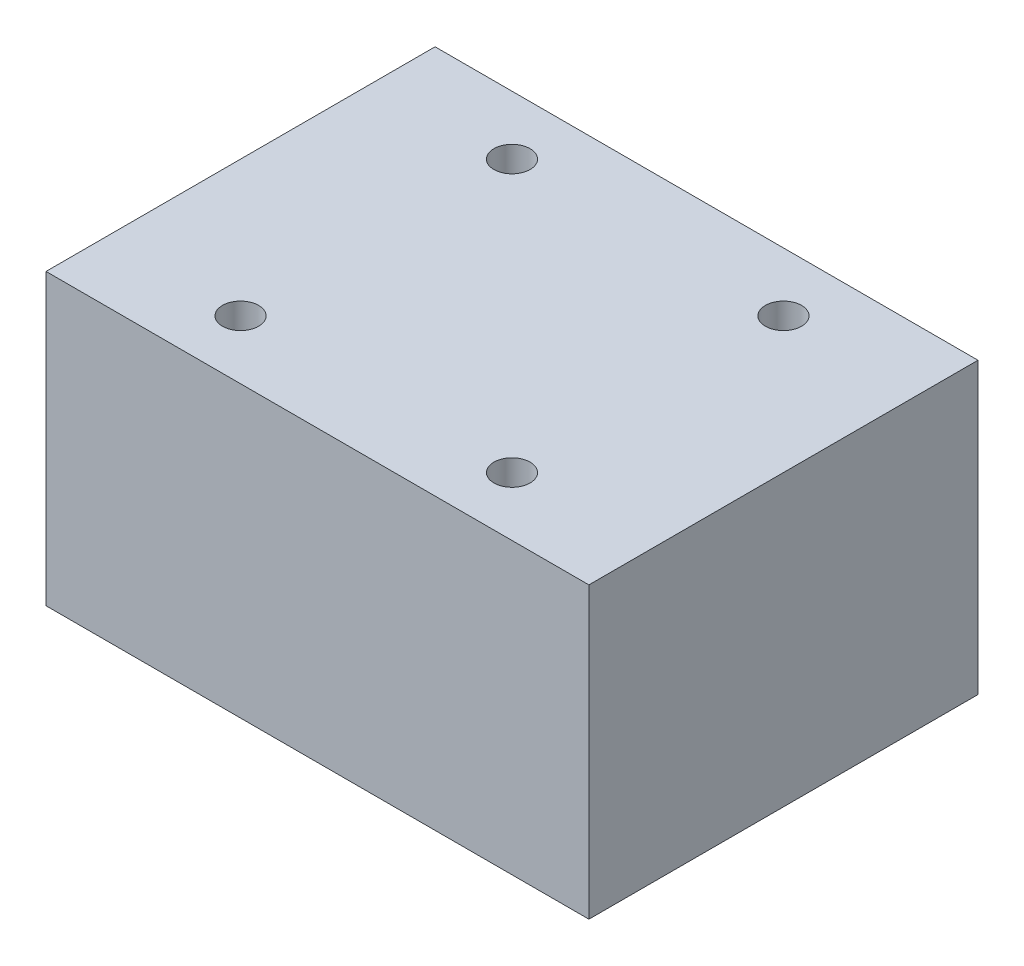
from build123d import *

# Parameters (mm, degrees)
SKETCH1_W             = 60
SKETCH1_H             = 43
BOSS_EXTRUDE1_DEPTH   = 32
F_4_0MM_DOWEL_HOLE1_D = 4


with BuildPart() as part:
    # Sketch1 → Boss-Extrude1 (new body)
    with BuildSketch(Plane(origin=(0, 0, 0), x_dir=(1, 0, 0), z_dir=(0, 1, 0))):
        Rectangle(SKETCH1_W, SKETCH1_H)
    extrude(amount=BOSS_EXTRUDE1_DEPTH)

    # Ø4.0mm Dowel Hole1 (through all)
    with Locations(Plane(origin=(-15, 32, -15), x_dir=(0, 0, 1), z_dir=(0, 1, 0))):
        with Locations((0, 0), (30, 0), (30, 30), (0, 30)):
            Hole(F_4_0MM_DOWEL_HOLE1_D / 2)


solid = part.part
